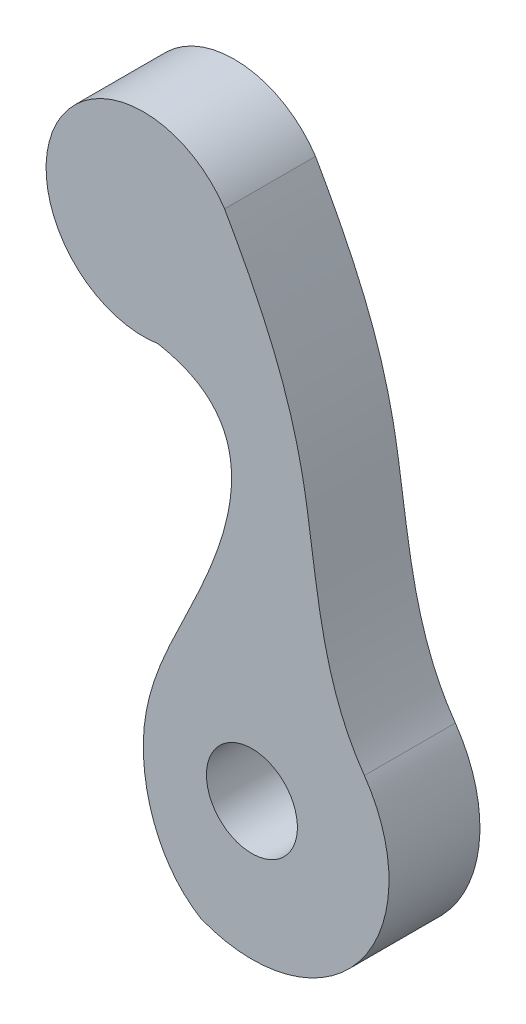
from build123d import *

# Parameters (mm, degrees)
CROQUIS1_R              = 2.499999999
SALIENTE_EXTRUIR1_DEPTH = 5


with BuildPart() as part:
    # Croquis1 → Saliente-Extruir1 (new body)
    with BuildSketch(Plane.XY.offset(5)):
        with BuildLine():
            ThreePointArc((-1.502391268, 27.446296254), (-10.857150944, 26.658474231), (-5.165151301, 19.192998211))
            add(Edge.make_bspline(
                [(-5.165151301, 19.192998211), (0.561959139, 18.161248815), (-2.0209311, 9.093501776), (-7.220176541, 0.935588497), (-5.098734301, -5.629541665), (-2.791423521, -7.000958644)],
                knots=[0, 0, 0, 0, 0.419324493, 0.73408421, 1, 1, 1, 1], degree=3))
            ThreePointArc((-2.791423521, -7.000958644), (5.90367611, -4.685304218), (6.184039559, 4.308494165))
            add(Edge.make_bspline(
                [(6.184039559, 4.308494165), (3.613892894, 7.929527917), (3.595744884, 16.916271928), (0.755595428, 23.472120645), (-1.502391268, 27.446296254)],
                knots=[0, 0, 0, 0, 0.531518306, 1, 1, 1, 1], degree=3))
        make_face()
        with Locations(Location((1e-09, 1e-09, 0), (0, 0, 180))):
            Circle(CROQUIS1_R, mode=Mode.SUBTRACT)
    extrude(amount=-SALIENTE_EXTRUIR1_DEPTH)


solid = part.part
